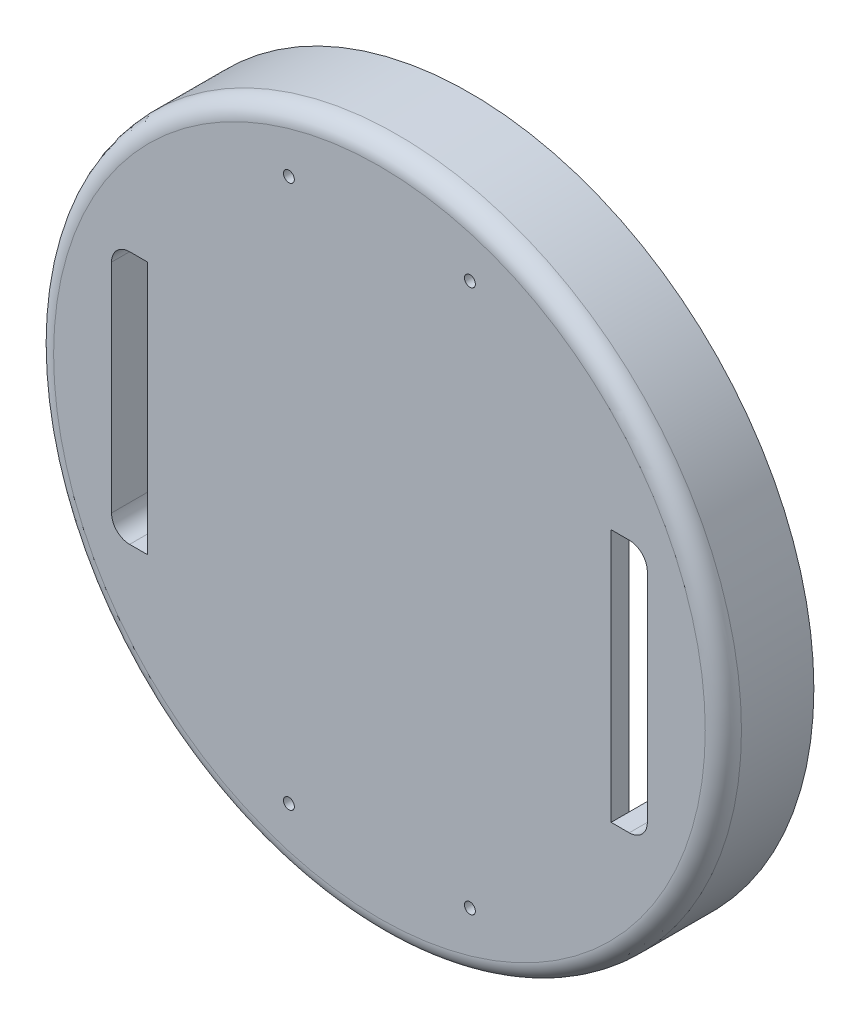
from build123d import *

# Parameters (mm, degrees)
SKETCH_1_R               = 95
EXTRUDE_1_DEPTH          = 20
SKETCH_2_R               = 95
EXTRUDE_2_DEPTH          = 5
FILLET_1_R               = 5
SKETCH_5_R               = 1.5
CUT_EXTRUDE_2_DEPTH      = 137.656503775
CUT_EXTRUDE_9_DEPTH      = 136.830777142
CUT_EXTRUDE_9_DEPTH_BACK = 136.830777142


with BuildPart() as part:
    # 草圖1 → 填料-伸長1 (new body)
    with BuildSketch(Plane.XY):
        Circle(SKETCH_1_R)
        Polygon((64, 64), (-64, 64), (-64, 34.210333771), (-64, -34.210333771), (-64, -64), (64, -64), (64, -34.210333771), (64, 34.210333771), align=None, mode=Mode.SUBTRACT)
    extrude(amount=EXTRUDE_1_DEPTH)

    # 草圖2 → 填料-伸長2 (add)
    with BuildSketch(Plane.XY.offset(20)):
        Circle(SKETCH_2_R)
    extrude(amount=EXTRUDE_2_DEPTH)

    # 圓角1
    fillet_1_edges = [part.edges().sort_by_distance(p)[0] for p in [
        (-95, 0, 25),
    ]]
    fillet(fillet_1_edges, radius=FILLET_1_R)

    # 草圖5 → 除料-伸長2 (cut, through all)
    with BuildSketch(Plane(origin=(0, 0, 0), x_dir=(-1, 0, 0), z_dir=(0, 0, -1))):
        with Locations((-25, 75)):
            Circle(SKETCH_5_R)
        with Locations((25, 75)):
            Circle(SKETCH_5_R)
        with Locations((25, -75)):
            Circle(SKETCH_5_R)
        with Locations((-25, -75)):
            Circle(SKETCH_5_R)
    extrude(amount=-CUT_EXTRUDE_2_DEPTH, mode=Mode.SUBTRACT)

    # 草圖6 → 除料-伸長9 (cut, two sides: drawn at the far end of the back side and taken through both)
    with BuildSketch(Plane(origin=(0, 0, 20), x_dir=(-1, 0, 0), z_dir=(0, 0, -1)).offset(-CUT_EXTRUDE_9_DEPTH_BACK)):
        with BuildLine():
            Line((-64, 35), (-64, -35))
            Line((-64, -35), (-69, -35))
            ThreePointArc((-69, -35), (-72.535533906, -33.535533906), (-74, -30))
            Line((-74, -30), (-74, 30))
            ThreePointArc((-74, 30), (-72.535533906, 33.535533906), (-69, 35))
            Line((-69, 35), (-64, 35))
        make_face()
        with BuildLine():
            Line((64, -35), (69, -35))
            ThreePointArc((69, -35), (72.535533906, -33.535533906), (74, -30))
            Line((74, -30), (74, 30))
            ThreePointArc((74, 30), (72.535533906, 33.535533906), (69, 35))
            Line((69, 35), (64, 35))
            Line((64, 35), (64, -35))
        make_face()
    extrude(amount=CUT_EXTRUDE_9_DEPTH + CUT_EXTRUDE_9_DEPTH_BACK, mode=Mode.SUBTRACT)


solid = part.part
